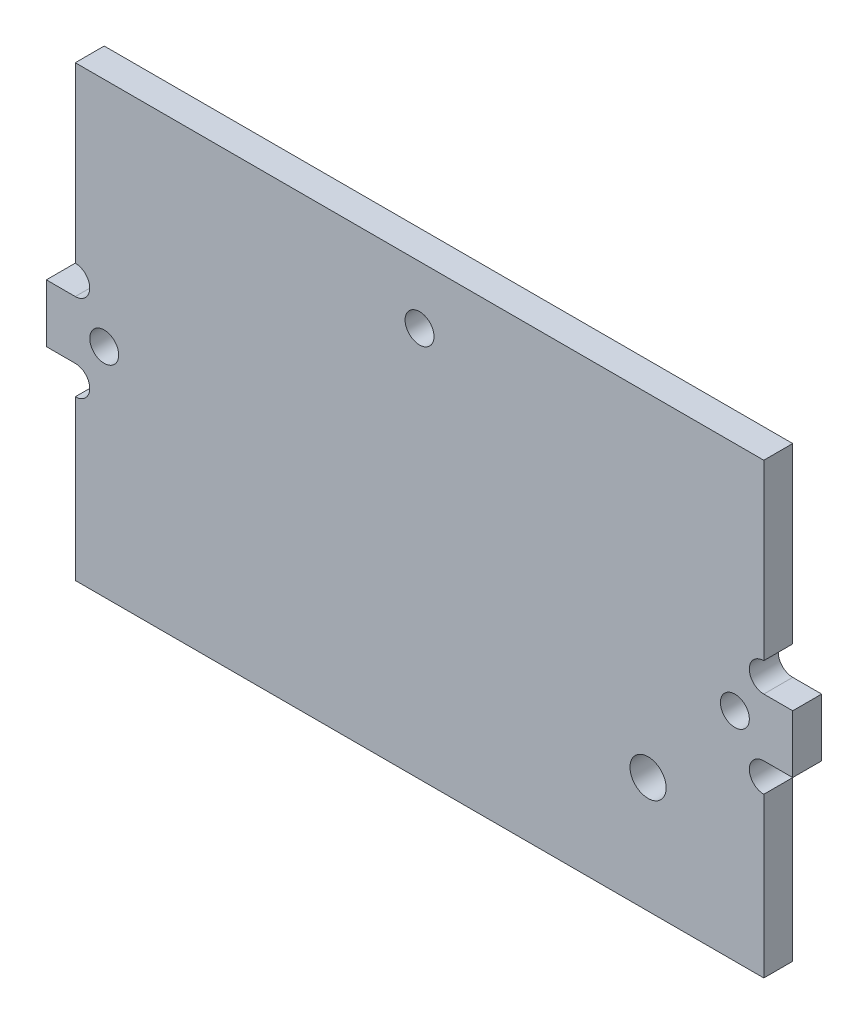
from build123d import *

# Parameters (mm, degrees)
SKETCH_1_R      = 1.25
SKETCH_1_R_2    = 1
EXTRUDE_2_DEPTH = 2


with BuildPart() as part:
    # 草圖1 → 填料-伸長2 (new body)
    with BuildSketch(Plane.XY):
        with BuildLine():
            Line((18.058094933, -13.1179941), (-27.541905067, -13.1179941))
            Line((-27.541905067, -13.1179941), (-28.541905067, -13.1179941))
            Line((-28.541905067, -13.1179941), (-28.541905067, -12.1179941))
            Line((-28.541905067, -12.1179941), (-28.541905067, -2.1179941))
            ThreePointArc((-28.541905067, -2.1179941), (-27.541905067, -1.1179941), (-28.541905067, -0.1179941))
            Line((-28.541905067, -0.1179941), (-30.541905067, -0.1179941))
            Line((-30.541905067, -0.1179941), (-30.541905067, 3.8820059))
            Line((-30.541905067, 3.8820059), (-28.541905067, 3.8820059))
            ThreePointArc((-28.541905067, 3.8820059), (-27.541905067, 4.8820059), (-28.541905067, 5.8820059))
            Line((-28.541905067, 5.8820059), (-28.541905067, 9.8820059))
            Line((-28.541905067, 9.8820059), (-28.541905067, 10.8820059))
            Line((-28.541905067, 10.8820059), (-28.541905067, 16.8820059))
            Line((-28.541905067, 16.8820059), (-28.541905067, 17.8820059))
            Line((-28.541905067, 17.8820059), (-27.541905067, 17.8820059))
            Line((-27.541905067, 17.8820059), (18.058094933, 17.8820059))
            Line((18.058094933, 17.8820059), (19.058094933, 17.8820059))
            Line((19.058094933, 17.8820059), (19.058094933, 16.8820059))
            Line((19.058094933, 16.8820059), (19.058094933, 10.8820059))
            Line((19.058094933, 10.8820059), (19.058094933, 9.8820059))
            Line((19.058094933, 9.8820059), (19.058094933, 5.8820059))
            ThreePointArc((19.058094933, 5.8820059), (18.058094933, 4.8820059), (19.058094933, 3.8820059))
            Line((19.058094933, 3.8820059), (21.058094933, 3.8820059))
            Line((21.058094933, 3.8820059), (21.058094933, -0.1179941))
            Line((21.058094933, -0.1179941), (19.058094933, -0.1179941))
            ThreePointArc((19.058094933, -0.1179941), (18.058094933, -1.1179941), (19.058094933, -2.1179941))
            Line((19.058094933, -2.1179941), (19.058094933, -12.1179941))
            Line((19.058094933, -12.1179941), (19.058094933, -13.1179941))
            Line((19.058094933, -13.1179941), (18.058094933, -13.1179941))
        make_face()
        with Locations((11.058094933, -5.1179941)):
            Circle(SKETCH_1_R, mode=Mode.SUBTRACT)
        with Locations((-26.541905067, 1.8820059)):
            Circle(SKETCH_1_R_2, mode=Mode.SUBTRACT)
        with Locations((17.058094933, 1.8820059)):
            Circle(SKETCH_1_R_2, mode=Mode.SUBTRACT)
        with Locations((-4.741905067, 13.8820059)):
            Circle(SKETCH_1_R_2, mode=Mode.SUBTRACT)
    extrude(amount=EXTRUDE_2_DEPTH)


solid = part.part
